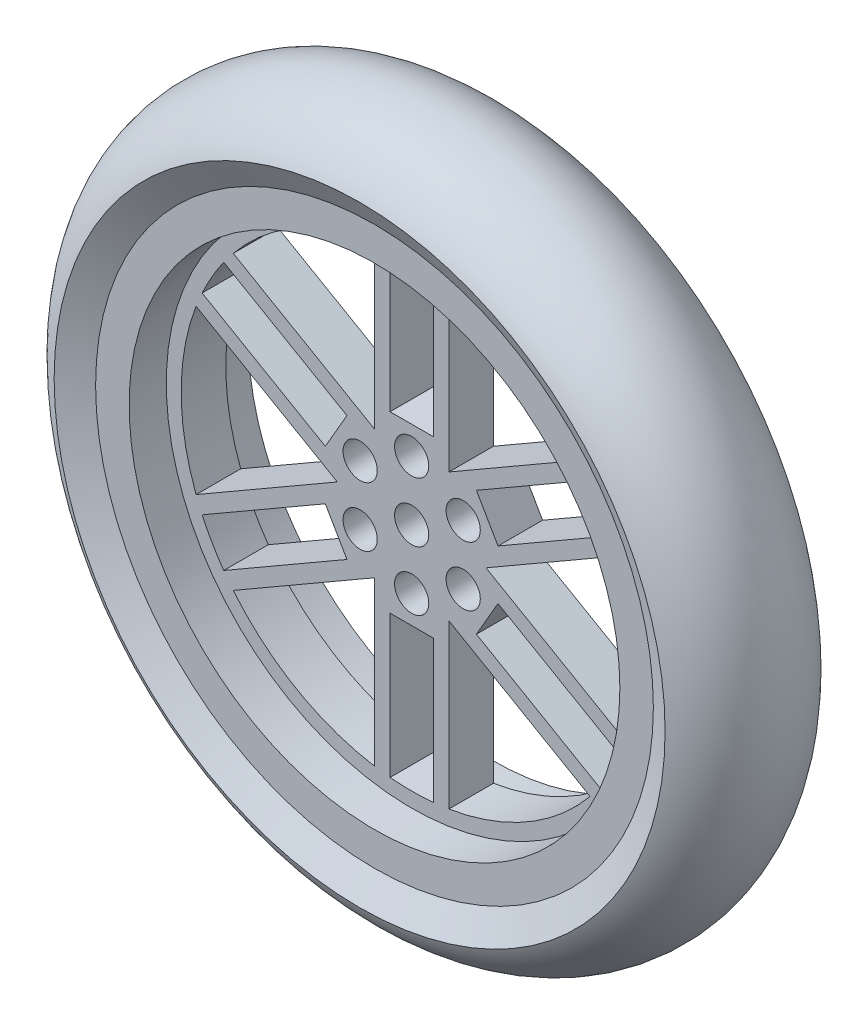
from build123d import *

# Parameters (mm, degrees)
SKETCH_2_R          = 37.505158637
SKETCH_2_R_2        = 2.3
EXTRUDE_2_DEPTH     = 8
SKETCH_3_R          = 33
CUT_EXTRUDE_1_DEPTH = 5
CUT_EXTRUDE_START   = -11
SKETCH_3_2_R        = 33
CUT_EXTRUDE_2_DEPTH = 5


with BuildPart() as part:
    # 草图1 → 旋转1 (revolve)
    with BuildSketch(Plane(origin=(0, 0, 0), x_dir=(0, 0, -1), z_dir=(1, 0, 0)), mode=Mode.PRIVATE) as revolve_1_sk:
        with BuildLine():
            Line((-8, 37.505158637), (8, 37.505158637))
            Line((8, 37.505158637), (10, 41.082575695))
            ThreePointArc((10, 41.082575695), (0, 47.5), (-10, 41.082575695))
            Line((-10, 41.082575695), (-8, 37.505158637))
        make_face()
    revolve(revolve_1_sk.sketch.rotate(Axis((0, 0, 15.4), (0, 0, -1)), 90), axis=Axis((0, 0, 15.4), (0, 0, -1)))

    # 草图2 → 凸台-拉伸2 (add, symmetric)
    with BuildSketch(Plane.XY):
        Circle(SKETCH_2_R)
        Circle(SKETCH_2_R_2, mode=Mode.SUBTRACT)
        with Locations((0, 8)):
            Circle(SKETCH_2_R_2, mode=Mode.SUBTRACT)
        with Locations((6.92820323, 4)):
            Circle(SKETCH_2_R_2, mode=Mode.SUBTRACT)
        with Locations((6.92820323, -4)):
            Circle(SKETCH_2_R_2, mode=Mode.SUBTRACT)
        with Locations((0, -8)):
            Circle(SKETCH_2_R_2, mode=Mode.SUBTRACT)
        with Locations((-6.92820323, -4)):
            Circle(SKETCH_2_R_2, mode=Mode.SUBTRACT)
        with Locations((-6.92820323, 4)):
            Circle(SKETCH_2_R_2, mode=Mode.SUBTRACT)
        with BuildLine():
            Line((5, 30.594117082), (5, 8.660254038))
            Line((5, 8.660254038), (23.995282599, 19.62718556))
            ThreePointArc((23.995282599, 19.62718556), (15.5, 26.846787517), (5, 30.594117082))
        make_face(mode=Mode.SUBTRACT)
        with BuildLine():
            Line((10, 0), (28.995282599, -10.966931522))
            ThreePointArc((28.995282599, -10.966931522), (31, 0), (28.995282599, 10.966931522))
            Line((28.995282599, 10.966931522), (10, 0))
        make_face(mode=Mode.SUBTRACT)
        with BuildLine():
            Line((5, -8.660254038), (5, -30.594117082))
            ThreePointArc((5, -30.594117082), (15.5, -26.846787517), (23.995282599, -19.62718556))
            Line((23.995282599, -19.62718556), (5, -8.660254038))
        make_face(mode=Mode.SUBTRACT)
        with BuildLine():
            Line((-5, -8.660254038), (-23.995282599, -19.62718556))
            ThreePointArc((-23.995282599, -19.62718556), (-15.5, -26.846787517), (-5, -30.594117082))
            Line((-5, -30.594117082), (-5, -8.660254038))
        make_face(mode=Mode.SUBTRACT)
        with BuildLine():
            Line((-10, 0), (-28.995282599, 10.966931522))
            ThreePointArc((-28.995282599, 10.966931522), (-31, 0), (-28.995282599, -10.966931522))
            Line((-28.995282599, -10.966931522), (-10, 0))
        make_face(mode=Mode.SUBTRACT)
        with BuildLine():
            Line((-5, 8.660254038), (-5, 30.594117082))
            ThreePointArc((-5, 30.594117082), (-15.5, 26.846787517), (-23.995282599, 19.62718556))
            Line((-23.995282599, 19.62718556), (-5, 8.660254038))
        make_face(mode=Mode.SUBTRACT)
        with BuildLine():
            Line((-2.90470199, 30.863614603), (-2.90470199, 11.729037589))
            Line((-2.90470199, 11.729037589), (2.90470199, 11.729037589))
            Line((2.90470199, 11.729037589), (2.90470199, 30.863614603))
            ThreePointArc((2.90470199, 30.863614603), (0, 31), (-2.90470199, 30.863614603))
        make_face(mode=Mode.SUBTRACT)
        with BuildLine():
            Line((8.705293519, 8.380064508), (11.609995509, 3.34897308))
            Line((11.609995509, 3.34897308), (28.181025294, 12.916261587))
            ThreePointArc((28.181025294, 12.916261587), (26.846787517, 15.5), (25.276323303, 17.947353015))
            Line((25.276323303, 17.947353015), (8.705293519, 8.380064508))
        make_face(mode=Mode.SUBTRACT)
        with BuildLine():
            Line((11.609995509, -3.34897308), (8.705293519, -8.380064508))
            Line((8.705293519, -8.380064508), (25.276323303, -17.947353015))
            ThreePointArc((25.276323303, -17.947353015), (26.846787517, -15.5), (28.181025294, -12.916261587))
            Line((28.181025294, -12.916261587), (11.609995509, -3.34897308))
        make_face(mode=Mode.SUBTRACT)
        with BuildLine():
            Line((2.90470199, -11.729037589), (-2.90470199, -11.729037589))
            Line((-2.90470199, -11.729037589), (-2.90470199, -30.863614603))
            ThreePointArc((-2.90470199, -30.863614603), (0, -31), (2.90470199, -30.863614603))
            Line((2.90470199, -30.863614603), (2.90470199, -11.729037589))
        make_face(mode=Mode.SUBTRACT)
        with BuildLine():
            Line((-8.705293519, -8.380064508), (-11.609995509, -3.34897308))
            Line((-11.609995509, -3.34897308), (-28.181025294, -12.916261587))
            ThreePointArc((-28.181025294, -12.916261587), (-26.846787517, -15.5), (-25.276323303, -17.947353015))
            Line((-25.276323303, -17.947353015), (-8.705293519, -8.380064508))
        make_face(mode=Mode.SUBTRACT)
        with BuildLine():
            Line((-11.609995509, 3.34897308), (-8.705293519, 8.380064508))
            Line((-8.705293519, 8.380064508), (-25.276323303, 17.947353015))
            ThreePointArc((-25.276323303, 17.947353015), (-26.846787517, 15.5), (-28.181025294, 12.916261587))
            Line((-28.181025294, 12.916261587), (-11.609995509, 3.34897308))
        make_face(mode=Mode.SUBTRACT)
    extrude(amount=EXTRUDE_2_DEPTH, both=True)

    # 草图3 → 切除-拉伸1 (cut)
    with BuildSketch(Plane.XY.offset(8)):
        Circle(SKETCH_3_R)
    extrude(amount=-CUT_EXTRUDE_1_DEPTH, mode=Mode.SUBTRACT)

    # 草图3<2> → 切除-拉伸2 (cut)
    with BuildSketch(Plane.XY.offset(8).offset(CUT_EXTRUDE_START)):
        Circle(SKETCH_3_2_R)
    extrude(amount=-CUT_EXTRUDE_2_DEPTH, mode=Mode.SUBTRACT)


solid = part.part
